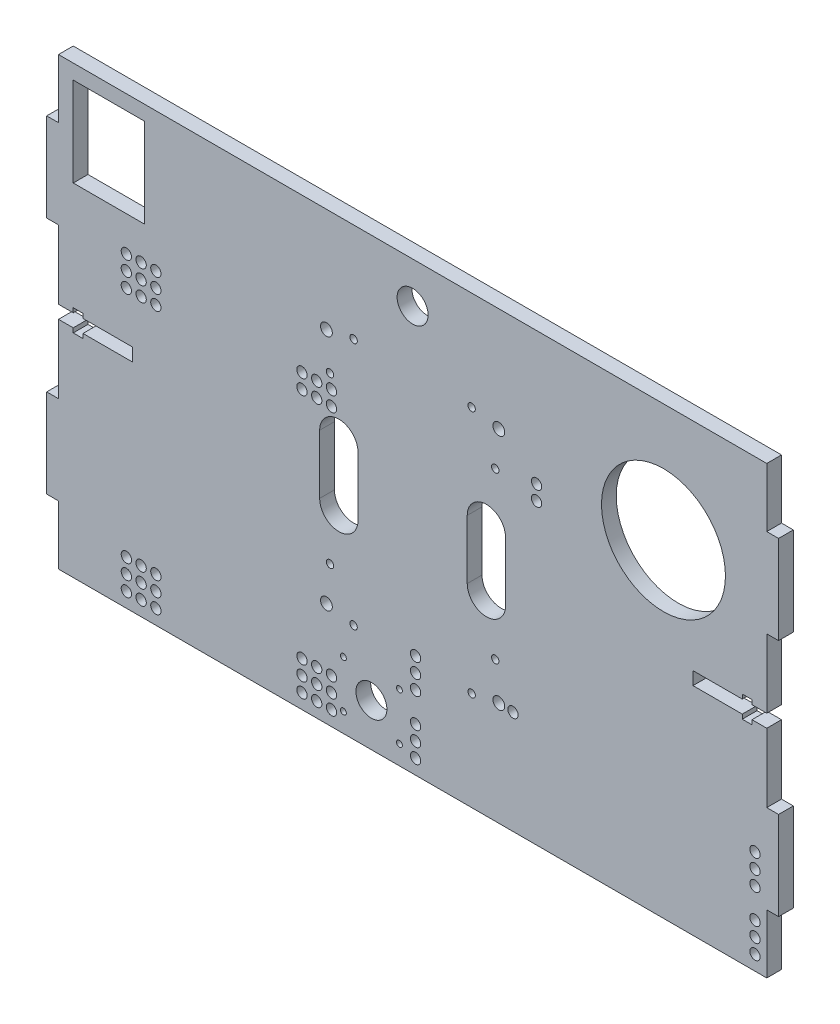
from build123d import *

# Parameters (mm, degrees)
SKETCH1_W           = 240
SKETCH1_H           = 151
BOSS_EXTRUDE1_DEPTH = 5
SKETCH2_R           = 1.25
CUT_EXTRUDE1_DEPTH  = 5
CUT_EXTRUDE2_DEPTH  = 10
SKETCH7_R           = 2
CUT_EXTRUDE4_DEPTH  = 10
SKETCH9_W           = 4
SKETCH9_H           = 30
BOSS_EXTRUDE2_DEPTH = 5
CUT_EXTRUDE6_DEPTH  = 5
SKETCH13_R          = 21
CUT_EXTRUDE9_DEPTH  = 10
SKETCH15_R          = 1.75
CUT_EXTRUDE11_DEPTH = 10
SKETCH16_R          = 1.75
CUT_EXTRUDE12_DEPTH = 10
SKETCH17_R          = 1.75
CUT_EXTRUDE13_DEPTH = 10
SKETCH20_W          = 24.2
SKETCH20_H          = 30.2
CUT_EXTRUDE14_DEPTH = 10
SKETCH21_R          = 5.25
CUT_EXTRUDE15_DEPTH = 5
SKETCH22_R          = 1
CUT_EXTRUDE16_DEPTH = 5
SKETCH23_R          = 5.25
CUT_EXTRUDE17_DEPTH = 10


with BuildPart() as part:
    # Sketch1 → Boss-Extrude1 (new body)
    with BuildSketch(Plane.XY):
        Rectangle(SKETCH1_W, SKETCH1_H)
    extrude(amount=BOSS_EXTRUDE1_DEPTH)

    # Sketch2 → Cut-Extrude1 (cut)
    with BuildSketch(Plane(origin=(0, 0, 0), x_dir=(-1, 0, 0), z_dir=(0, 0, -1))):
        with Locations(Location((-20, 42, 0), (0, 0, 180))):
            Circle(SKETCH2_R)
        with Locations((28, 28)):
            Circle(SKETCH2_R)
        with Locations(Location((20, 42, 0), (0, 0, 180))):
            Circle(SKETCH2_R)
        with Locations((-28, 28)):
            Circle(SKETCH2_R)
        with Locations(Location((-28, -28, 0), (0, 0, 180))):
            Circle(SKETCH2_R)
        with Locations((20, -42)):
            Circle(SKETCH2_R)
        with Locations(Location((28, -28, 0), (0, 0, 180))):
            Circle(SKETCH2_R)
        with Locations((-20, -42)):
            Circle(SKETCH2_R)
    extrude(amount=-CUT_EXTRUDE1_DEPTH, mode=Mode.SUBTRACT)

    # Sketch5 → Cut-Extrude2 (cut)
    with BuildSketch(Plane(origin=(0, 0, 0), x_dir=(-1, 0, 0), z_dir=(0, 0, -1))):
        with BuildLine():
            Line((18.5, -10.5), (18.5, 9.5))
            ThreePointArc((18.5, 9.5), (25, 16), (31.5, 9.5))
            Line((31.5, 9.5), (31.5, -10.5))
            ThreePointArc((31.5, -10.5), (25, -17), (18.5, -10.5))
        make_face()
        with BuildLine():
            Line((-18.5, -10.5), (-18.5, 9.5))
            ThreePointArc((-18.5, 9.5), (-25, 16), (-31.5, 9.5))
            Line((-31.5, 9.5), (-31.5, -10.5))
            ThreePointArc((-31.5, -10.5), (-25, -17), (-18.5, -10.5))
        make_face()
    extrude(amount=-CUT_EXTRUDE2_DEPTH, mode=Mode.SUBTRACT)

    # Sketch7 → Cut-Extrude4 (cut)
    with BuildSketch(Plane(origin=(0, 0, 0), x_dir=(-1, 0, 0), z_dir=(0, 0, -1))):
        with Locations((29.207613065, 40.217347852)):
            Circle(SKETCH7_R)
        with Locations((29.207613065, -40.217347852)):
            Circle(SKETCH7_R)
        with Locations(Location((-29.207613065, -40.217347852, 0), (0, 0, 180))):
            Circle(SKETCH7_R)
        with Locations(Location((-29.207613065, 40.217347852, 0), (0, 0, 180))):
            Circle(SKETCH7_R)
    extrude(amount=-CUT_EXTRUDE4_DEPTH, mode=Mode.SUBTRACT)

    # Sketch9 → Boss-Extrude2 (add)
    with BuildSketch(Plane(origin=(0, 0, 0), x_dir=(-1, 0, 0), z_dir=(0, 0, -1))):
        with Locations((122, 40.5)):
            Rectangle(SKETCH9_W, SKETCH9_H)
        with Locations((122, -40.5)):
            Rectangle(SKETCH9_W, SKETCH9_H)
        with Locations((-122, -40.5)):
            Rectangle(SKETCH9_W, SKETCH9_H)
        with Locations((-122, 40.5)):
            Rectangle(SKETCH9_W, SKETCH9_H)
    extrude(amount=-BOSS_EXTRUDE2_DEPTH)

    # Sketch10 → Cut-Extrude6 (cut)
    with BuildSketch(Plane(origin=(0, 0, 0), x_dir=(-1, 0, 0), z_dir=(0, 0, -1))):
        Polygon((-120, 2.2), (-115, 2.2), (-115, 3.7), (-111.7, 3.7), (-111.7, 2.2), (-95, 2.2), (-95, -2.2), (-111.7, -2.2), (-111.7, -3.7), (-115, -3.7), (-115, -2.2), (-120, -2.2), align=None)
        Polygon((115, -2.2), (120, -2.2), (120, 2.2), (115, 2.2), (115, 3.7), (111.7, 3.7), (111.7, 2.2), (95, 2.2), (95, -2.2), (111.7, -2.2), (111.7, -3.7), (115, -3.7), align=None)
    extrude(amount=-CUT_EXTRUDE6_DEPTH, mode=Mode.SUBTRACT)

    # Sketch13 → Cut-Extrude9 (cut)
    with BuildSketch(Plane(origin=(0, 0, 0), x_dir=(-1, 0, 0), z_dir=(0, 0, -1))):
        with Locations((-85, 35.5)):
            Circle(SKETCH13_R)
    extrude(amount=-CUT_EXTRUDE9_DEPTH, mode=Mode.SUBTRACT)

    # Sketch15 → Cut-Extrude11 (cut)
    with BuildSketch(Plane(origin=(0, 0, 0), x_dir=(-1, 0, 0), z_dir=(0, 0, -1))):
        with Locations((-34, -40.5)):
            Circle(SKETCH15_R)
    extrude(amount=-CUT_EXTRUDE11_DEPTH, mode=Mode.SUBTRACT)

    # Sketch16 → Cut-Extrude12 (cut)
    with BuildSketch(Plane(origin=(0, 0, 0), x_dir=(-1, 0, 0), z_dir=(0, 0, -1))):
        with Locations((-42, 25.5)):
            Circle(SKETCH16_R)
        with Locations((87, -70.5)):
            Circle(SKETCH16_R)
        with Locations((27.5, -70.5)):
            Circle(SKETCH16_R)
        with Locations((87, 18.5)):
            Circle(SKETCH16_R)
        with Locations((27.5, 18.5)):
            Circle(SKETCH16_R)
        with Locations((-42, 30.5)):
            Circle(SKETCH16_R)
        with Locations((27.5, 23.5)):
            Circle(SKETCH16_R)
        with Locations((87, -65.5)):
            Circle(SKETCH16_R)
        with Locations((87, 23.5)):
            Circle(SKETCH16_R)
        with Locations((27.5, -65.5)):
            Circle(SKETCH16_R)
        with Locations((87, -60.5)):
            Circle(SKETCH16_R)
        with Locations((87, 28.5)):
            Circle(SKETCH16_R)
        with Locations((27.5, -60.5)):
            Circle(SKETCH16_R)
        with Locations((32.5, -70.5)):
            Circle(SKETCH16_R)
        with Locations((92, -70.5)):
            Circle(SKETCH16_R)
        with Locations((32.5, -65.5)):
            Circle(SKETCH16_R)
        with Locations((32.5, -60.5)):
            Circle(SKETCH16_R)
        with Locations((92, -65.5)):
            Circle(SKETCH16_R)
        with Locations((92, -60.5)):
            Circle(SKETCH16_R)
        with Locations((32.5, 18.5)):
            Circle(SKETCH16_R)
        with Locations((32.5, 23.5)):
            Circle(SKETCH16_R)
        with Locations((92, 23.5)):
            Circle(SKETCH16_R)
        with Locations((92, 18.5)):
            Circle(SKETCH16_R)
        with Locations((92, 28.5)):
            Circle(SKETCH16_R)
        with Locations((37.5, -70.5)):
            Circle(SKETCH16_R)
        with Locations((97, -70.5)):
            Circle(SKETCH16_R)
        with Locations((37.5, -65.5)):
            Circle(SKETCH16_R)
        with Locations((37.5, -60.5)):
            Circle(SKETCH16_R)
        with Locations((97, -65.5)):
            Circle(SKETCH16_R)
        with Locations((97, -60.5)):
            Circle(SKETCH16_R)
        with Locations((37.5, 18.5)):
            Circle(SKETCH16_R)
        with Locations((37.5, 23.5)):
            Circle(SKETCH16_R)
        with Locations((97, 23.5)):
            Circle(SKETCH16_R)
        with Locations((97, 18.5)):
            Circle(SKETCH16_R)
        with Locations((97, 28.5)):
            Circle(SKETCH16_R)
    extrude(amount=-CUT_EXTRUDE12_DEPTH, mode=Mode.SUBTRACT)

    # Sketch17 → Cut-Extrude13 (cut)
    with BuildSketch(Plane(origin=(0, 0, 0), x_dir=(-1, 0, 0), z_dir=(0, 0, -1))):
        with Locations((-116, -70.5)):
            Circle(SKETCH17_R)
        with Locations((-116, -50.5)):
            Circle(SKETCH17_R)
        with Locations((-1, -50.5)):
            Circle(SKETCH17_R)
        with Locations((-1, -70.5)):
            Circle(SKETCH17_R)
        with Locations((-116, -45.5)):
            Circle(SKETCH17_R)
        with Locations((-116, -65.5)):
            Circle(SKETCH17_R)
        with Locations((-1, -45.5)):
            Circle(SKETCH17_R)
        with Locations((-1, -65.5)):
            Circle(SKETCH17_R)
        with Locations((-116, -40.5)):
            Circle(SKETCH17_R)
        with Locations((-116, -60.5)):
            Circle(SKETCH17_R)
        with Locations((-1, -40.5)):
            Circle(SKETCH17_R)
        with Locations((-1, -60.5)):
            Circle(SKETCH17_R)
    extrude(amount=-CUT_EXTRUDE13_DEPTH, mode=Mode.SUBTRACT)

    # Sketch20 → Cut-Extrude14 (cut)
    with BuildSketch(Plane(origin=(0, 0, 0), x_dir=(-1, 0, 0), z_dir=(0, 0, -1))):
        with Locations((102.9, 55.4)):
            Rectangle(SKETCH20_W, SKETCH20_H)
    extrude(amount=-CUT_EXTRUDE14_DEPTH, mode=Mode.SUBTRACT)

    # Sketch21 → Cut-Extrude15 (cut)
    with BuildSketch(Plane(origin=(0, 0, 0), x_dir=(-1, 0, 0), z_dir=(0, 0, -1))):
        with Locations((13.963511127, -61)):
            Circle(SKETCH21_R)
    extrude(amount=-CUT_EXTRUDE15_DEPTH, mode=Mode.SUBTRACT)

    # Sketch22 → Cut-Extrude16 (cut)
    with BuildSketch(Plane(origin=(0, 0, 0), x_dir=(-1, 0, 0), z_dir=(0, 0, -1))):
        with Locations((23.463511127, -53)):
            Circle(SKETCH22_R)
        with Locations((23.463511127, -69)):
            Circle(SKETCH22_R)
        with Locations((4.463511127, -53)):
            Circle(SKETCH22_R)
        with Locations((4.463511127, -69)):
            Circle(SKETCH22_R)
    extrude(amount=-CUT_EXTRUDE16_DEPTH, mode=Mode.SUBTRACT)

    # Sketch23 → Cut-Extrude17 (cut)
    with BuildSketch(Plane(origin=(0, 0, 0), x_dir=(-1, 0, 0), z_dir=(0, 0, -1))):
        with Locations((0, 61.653760848)):
            Circle(SKETCH23_R)
    extrude(amount=-CUT_EXTRUDE17_DEPTH, mode=Mode.SUBTRACT)


solid = part.part
